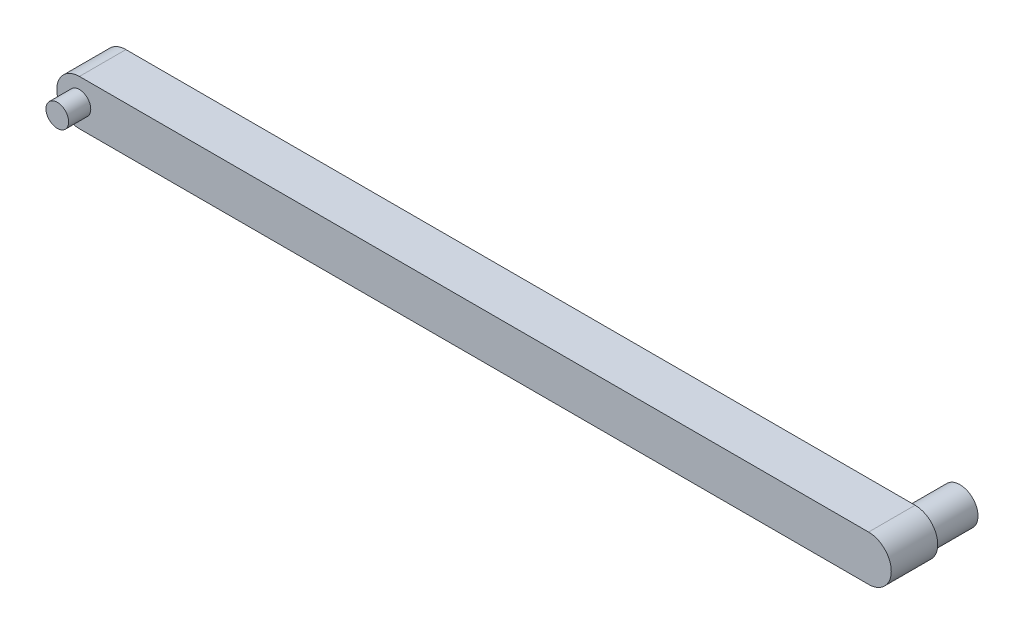
from build123d import *

# Parameters (mm, degrees)
BOSS_EXTRU_1_DEPTH = 5.125
ESQUISSE2_R        = 2.5
BOSS_EXTRU_2_DEPTH = 10
ESQUISSE3_R        = 4
BOSS_EXTRU_3_DEPTH = 15


with BuildPart() as part:
    # Esquisse1 → Boss.-Extru.1 (new, symmetric)
    with BuildSketch(Plane.XY):
        with BuildLine():
            Line((-28.790189362, 6.603053435), (145.209810638, 6.603053435))
            ThreePointArc((145.209810638, 6.603053435), (150.209810638, 1.603053435), (145.209810638, -3.396946565))
            Line((145.209810638, -3.396946565), (-28.790189362, -3.396946565))
            ThreePointArc((-28.790189362, -3.396946565), (-33.790189362, 1.603053435), (-28.790189362, 6.603053435))
        make_face()
    extrude(amount=BOSS_EXTRU_1_DEPTH, both=True)

    # Esquisse2 → Boss.-Extru.2 (add)
    with BuildSketch(Plane.XY):
        with Locations((-28.790189362, 1.603053435)):
            Circle(ESQUISSE2_R)
    extrude(amount=BOSS_EXTRU_2_DEPTH)

    # Esquisse3 → Boss.-Extru.3 (add)
    with BuildSketch(Plane.XY):
        with Locations((145.209810638, 1.603053435)):
            Circle(ESQUISSE3_R)
    extrude(amount=-BOSS_EXTRU_3_DEPTH)


solid = part.part
